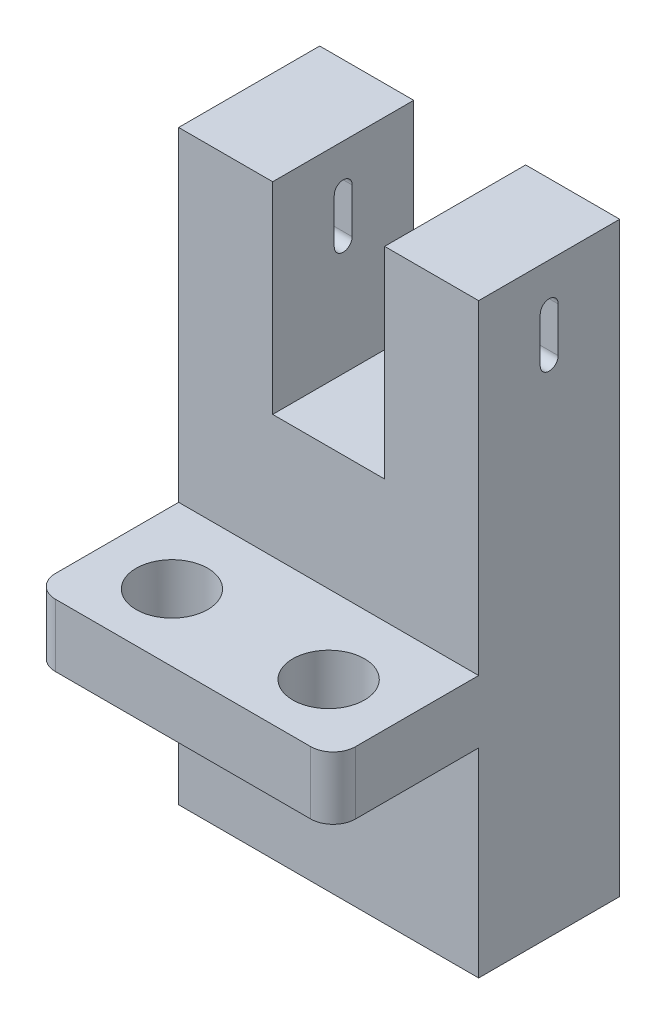
from build123d import *

# Parameters (mm, degrees)
EXTRUDE_1_DEPTH          = 6.7
CUT_EXTRUDE_1_DEPTH      = 29.713280899
CUT_EXTRUDE_1_DEPTH_BACK = 29.713280899
SKETCH_2_W               = 5
SKETCH_2_H               = 9
FILLET_1_R               = 1
SKETCH_3_R               = 1.6
CUT_EXTRUDE_2_DEPTH      = 13.4
CUT_EXTRUDE_3_DEPTH      = 31.969702937


with BuildPart() as part:
    # 草图1 → 凸台-拉伸1 (new, symmetric)
    with BuildSketch(Plane(origin=(0, 0, 0), x_dir=(0, 0, -1), z_dir=(1, 0, 0))):
        Polygon((3.15, 0), (-3.15, 0), (-3.15, 8.9), (-9.65, 8.9), (-9.65, 11.7), (-3.15, 11.7), (-3.15, 26.2), (3.15, 26.2), align=None)
    extrude(amount=EXTRUDE_1_DEPTH, both=True)

    # 草图2 → 切除-拉伸1 (cut, two sides: drawn at the far end of the back side and taken through both)
    with BuildSketch(Plane.XY.offset(-CUT_EXTRUDE_1_DEPTH_BACK)):
        with Locations((0, 21.7)):
            Rectangle(SKETCH_2_W, SKETCH_2_H)
    extrude(amount=CUT_EXTRUDE_1_DEPTH + CUT_EXTRUDE_1_DEPTH_BACK, mode=Mode.SUBTRACT)

    # 圆角1
    fillet_1_edges = [part.edges().sort_by_distance(p)[0] for p in [
        (6.7, 10.3, 9.65),
        (-6.7, 10.3, 9.65),
    ]]
    fillet(fillet_1_edges, radius=FILLET_1_R)

    # 草图3 → 切除-拉伸2 (cut)
    with BuildSketch(Plane(origin=(0, 11.7, 0), x_dir=(1, 0, 0), z_dir=(0, 1, 0))):
        with Locations(Location((3.5, -6.65, 0), (0, 0, 270))):
            Circle(SKETCH_3_R)
        with Locations(Location((-3.5, -6.65, 0), (0, 0, 270))):
            Circle(SKETCH_3_R)
    extrude(amount=-CUT_EXTRUDE_2_DEPTH, mode=Mode.SUBTRACT)

    # 草图4 → 切除-拉伸3 (cut, through all)
    with BuildSketch(Plane(origin=(6.7, 0, 0), x_dir=(0, 0, -1), z_dir=(1, 0, 0))):
        with BuildLine():
            Line((0.4, 24.3), (0.4, 22.3))
            ThreePointArc((0.4, 22.3), (0, 21.9), (-0.4, 22.3))
            Line((-0.4, 22.3), (-0.4, 24.3))
            ThreePointArc((-0.4, 24.3), (0, 24.7), (0.4, 24.3))
        make_face()
    extrude(amount=-CUT_EXTRUDE_3_DEPTH, mode=Mode.SUBTRACT)


solid = part.part
